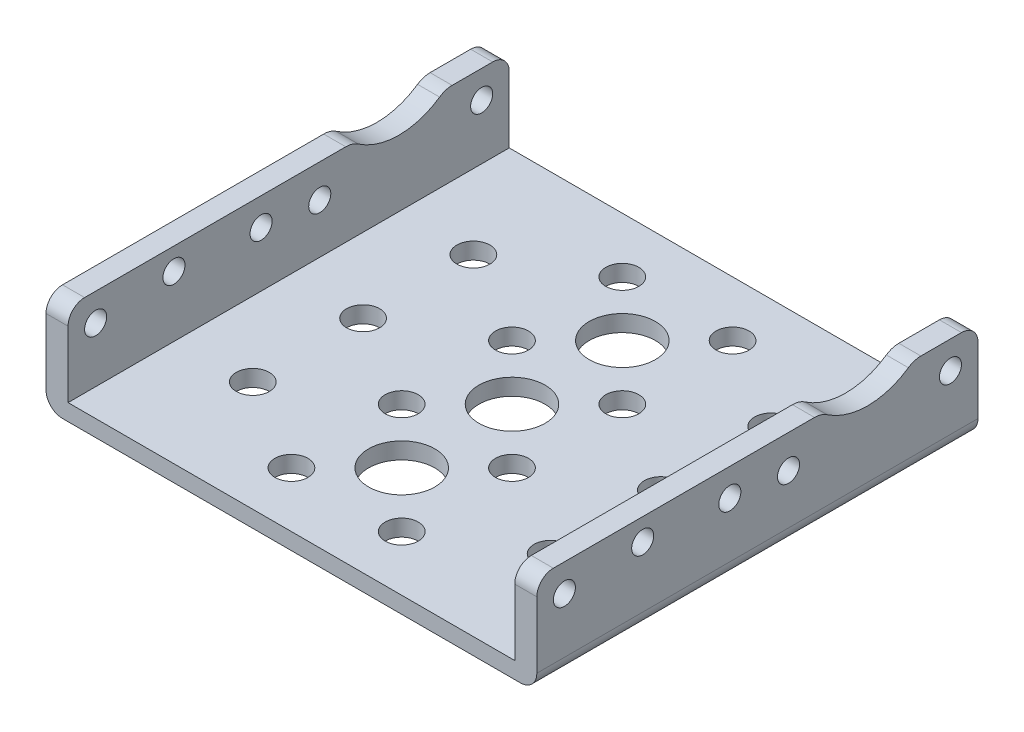
from build123d import *

# Parameters (mm, degrees)
SKETCH_1_W                = 44.5
SKETCH_1_H                = 40
EXTRUDE_1_DEPTH           = 9
SKETCH_2_W                = 40.5
SKETCH_2_H                = 7.5
CUT_EXTRUDE_1_DEPTH       = 47.64828507
CUT_EXTRUDE_2_REACH       = 51.611
CUT_EXTRUDE_3_DEPTH       = 50.610986686
HOLE_WIZARD_6_0_6_1_D     = 6
HOLE_WIZARD_6_0_6_1_DEPTH = 9
HOLE_WIZARD_3_0_3_1_D     = 3
HOLE_WIZARD_3_0_3_1_DEPTH = 9
HOLE_WIZARD_2_0_2_1_D     = 2
HOLE_WIZARD_2_0_2_1_DEPTH = 2
HOLE_WIZARD_2_0_2_2_D     = 2
HOLE_WIZARD_2_0_2_2_DEPTH = 44.5
FILLET_1_R                = 1.5
FILLET_2_R                = 2


with BuildPart() as part:
    # 草图1 → 凸台-拉伸1 (new body)
    with BuildSketch(Plane(origin=(0, 9, 0), x_dir=(1, 0, 0), z_dir=(0, 1, 0))):
        Rectangle(SKETCH_1_W, SKETCH_1_H)
    extrude(amount=-EXTRUDE_1_DEPTH)

    # 草图2 → 切除-拉伸1 (cut, through all)
    with BuildSketch(Plane(origin=(0, 0, -20), x_dir=(-1, 0, 0), z_dir=(0, 0, -1))):
        with Locations((0, 5.25)):
            Rectangle(SKETCH_2_W, SKETCH_2_H)
    extrude(amount=-CUT_EXTRUDE_1_DEPTH, mode=Mode.SUBTRACT)

    # 草图3 → 切除-拉伸2 (cut, up to next)
    with BuildSketch(Plane(origin=(22.25, 0, 0), x_dir=(0, 0, -1), z_dir=(1, 0, 0)), mode=Mode.PRIVATE) as cut_extrude_2_sk1:
        with BuildLine():
            Line((14.153311931, 9), (5.846688069, 9))
            ThreePointArc((5.846688069, 9), (10, 7.5), (14.153311931, 9))
        make_face()
    cut_extrude_2_tool1 = extrude(cut_extrude_2_sk1.sketch, amount=-CUT_EXTRUDE_2_REACH, mode=Mode.PRIVATE) & part.part
    add(cut_extrude_2_tool1.solids().sort_by_distance((22.25, 8.39364, -10))[0], mode=Mode.SUBTRACT)

    # 草图4 → 切除-拉伸3 (cut, through all)
    with BuildSketch(Plane.ZY.offset(22.25)):
        with BuildLine():
            Line((-5.846688069, 9), (-14.153311931, 9))
            ThreePointArc((-14.153311931, 9), (-10, 7.5), (-5.846688069, 9))
        make_face()
    extrude(amount=-CUT_EXTRUDE_3_DEPTH, mode=Mode.SUBTRACT)

    # Ø6.0 (6) 直径孔1
    with Locations(Plane(origin=(0, 0, 0), x_dir=(-1, 0, 0), z_dir=(0, -1, 0))):
        with Locations((0, 0), (0, 10), (0, -10)):
            Hole(HOLE_WIZARD_6_0_6_1_D / 2, depth=HOLE_WIZARD_6_0_6_1_DEPTH)

    # Ø3.0 (3) 直径孔1
    with Locations(Plane(origin=(0, 0, 0), x_dir=(-1, 0, 0), z_dir=(0, -1, 0))):
        with Locations((5, 5), (-5, 5), (-5, -5), (5, -5), (5, 15), (-5, 15), (-5, -15), (5, -15), (13.5, 10), (13.5, 0), (13.5, -10), (-13.5, 10), (-13.5, 0), (-13.5, -10)):
            Hole(HOLE_WIZARD_3_0_3_1_D / 2, depth=HOLE_WIZARD_3_0_3_1_DEPTH)

    # Ø2.0 (2) 直径孔1
    with Locations(Plane.ZY.offset(22.25)):
        with Locations((-17.5, 6.5), (2.5, 6.5), (10.4, 7), (17.5, 6.5), (-2.82, 6)):
            Hole(HOLE_WIZARD_2_0_2_1_D / 2, depth=HOLE_WIZARD_2_0_2_1_DEPTH)

    # Ø2.0 (2) 直径孔2
    with Locations(Plane(origin=(22.25, 0, 0), x_dir=(0, 0, -1), z_dir=(1, 0, 0))):
        with Locations((17.5, 6.5), (-2.5, 6.5), (-10.4, 7), (-17.5, 6.5), (2.82, 6)):
            Hole(HOLE_WIZARD_2_0_2_2_D / 2, depth=HOLE_WIZARD_2_0_2_2_DEPTH)

    # 圆角1
    fillet_1_edges = [part.edges().sort_by_distance(p)[0] for p in [
        (22.25, 0, 0),
        (21.25, 9, 20),
        (-21.25, 9, -20),
        (-22.25, 0, 0),
        (21.25, 9, -20),
        (-21.25, 9, 20),
    ]]
    fillet(fillet_1_edges, radius=FILLET_1_R)

    # 圆角2
    fillet_2_edges = [part.edges().sort_by_distance(p)[0] for p in [
        (21.25, 9, -5.846688069),
        (21.25, 9, -14.153311931),
        (-21.25, 9, -5.846688069),
        (-21.25, 9, -14.153311931),
    ]]
    fillet(fillet_2_edges, radius=FILLET_2_R)


solid = part.part
